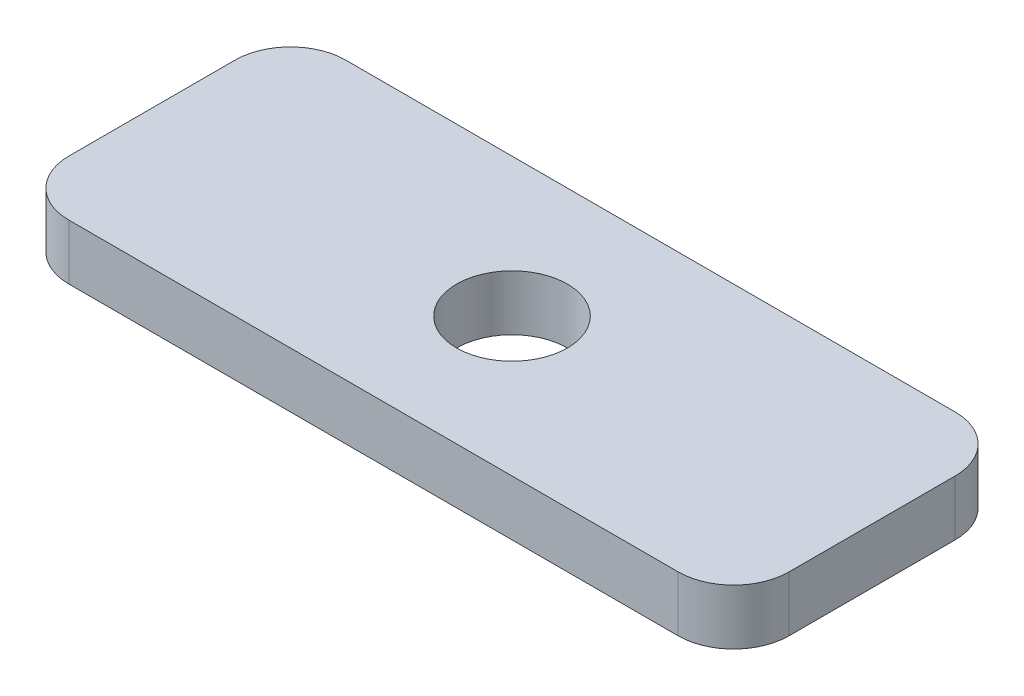
from build123d import *

# Parameters (mm, degrees)
SKETCH1_W           = 26
SKETCH1_H           = 10
SKETCH1_R           = 2
BOSS_EXTRUDE1_DEPTH = 2
FILLET1_R           = 2


with BuildPart() as part:
    # Sketch1 → Boss-Extrude1 (new body)
    with BuildSketch(Plane(origin=(0, 0, 0), x_dir=(1, 0, 0), z_dir=(0, 1, 0))):
        with Locations((13, 5)):
            Rectangle(SKETCH1_W, SKETCH1_H)
        with Locations(Location((13, 5, 0), (0, 0, 270))):
            Circle(SKETCH1_R, mode=Mode.SUBTRACT)
    extrude(amount=BOSS_EXTRUDE1_DEPTH)

    # Fillet1
    fillet1_edges = [part.edges().sort_by_distance(p)[0] for p in [
        (0, 1, -10),
        (26, 1, -10),
        (26, 1, 0),
        (0, 1, 0),
    ]]
    fillet(fillet1_edges, radius=FILLET1_R)


solid = part.part
